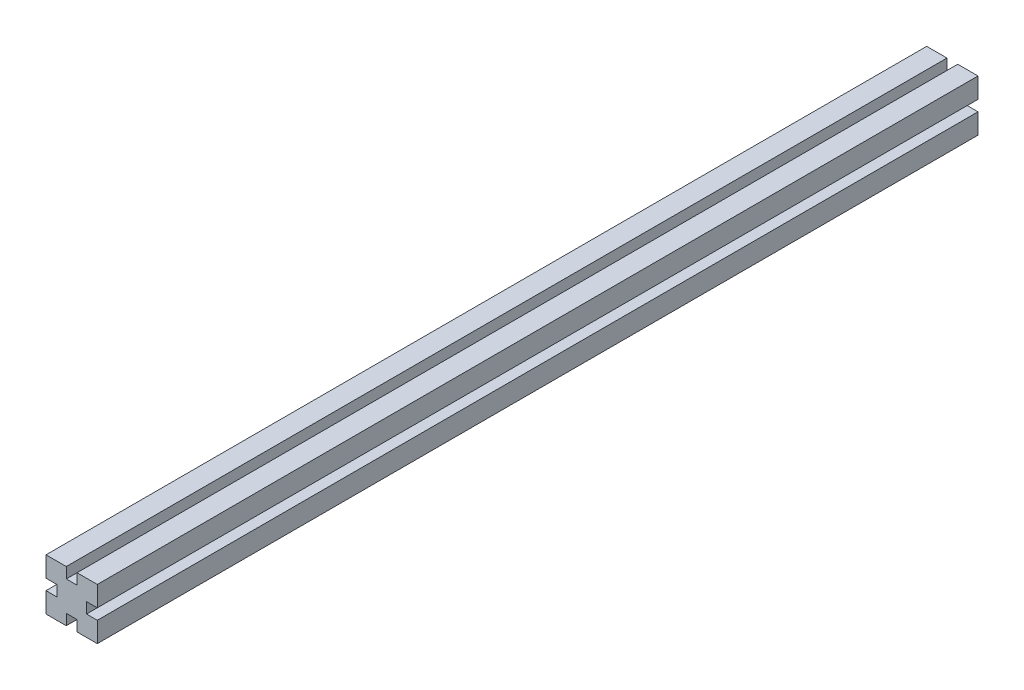
from build123d import *

# Parameters (mm, degrees)
PROFILE_DEPTH = 654.05


with BuildPart() as part:
    # Sketch1 → Profile (new body)
    with BuildSketch(Plane.XY):
        Polygon((-19.05, -19.05), (-4, -19.05), (-4, -11.05), (4, -11.05), (4, -19.05), (19.05, -19.05), (19.05, -4), (11.05, -4), (11.05, 4), (19.05, 4), (19.05, 19.05), (4, 19.05), (4, 11.05), (-4, 11.05), (-4, 19.05), (-19.05, 19.05), (-19.05, 4), (-11.05, 4), (-11.05, -4), (-19.05, -4), align=None)
    extrude(amount=PROFILE_DEPTH)


solid = part.part
